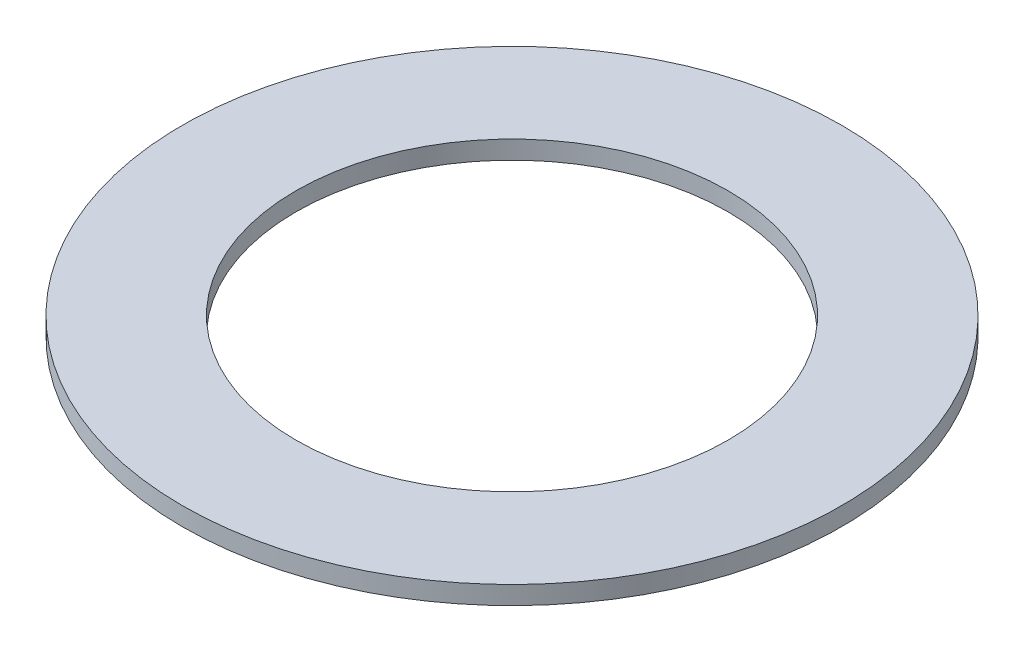
from build123d import *

# Parameters (mm, degrees)
SKETCH1_R           = 9
SKETCH1_R_2         = 5.9
BOSS_EXTRUDE1_DEPTH = 0.5


with BuildPart() as part:
    # Sketch1 → Boss-Extrude1 (new body)
    with BuildSketch(Plane(origin=(0, 0, 0), x_dir=(1, 0, 0), z_dir=(0, 1, 0))):
        with Locations(Location((0, 0, 0), (0, 0, 270))):
            Circle(SKETCH1_R)
        with Locations(Location((0, 0, 0), (0, 0, 270))):
            Circle(SKETCH1_R_2, mode=Mode.SUBTRACT)
    extrude(amount=BOSS_EXTRUDE1_DEPTH)


solid = part.part
